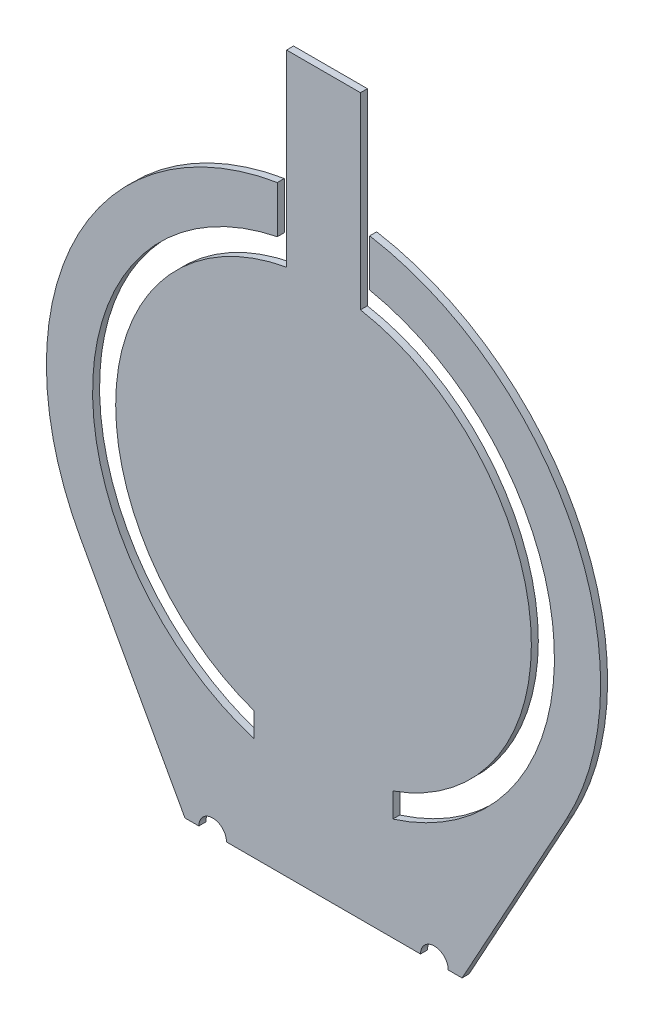
from build123d import *

# Parameters (mm, degrees)
BOSS_EXTRUDE1_DEPTH      = 0.75438
CORTE_EXTRUS_O1_START    = -10
CORTE_EXTRUS_O1_DEPTH    = 10
RESSALTO_EXTRUS_O1_START = -0.75438
RESSALTO_EXTRUS_O1_DEPTH = 0.75438
CORTE_EXTRUS_O2_DEPTH    = 10


with BuildPart() as part:
    # Sketch1 → Boss-Extrude1 (new body)
    with BuildSketch(Plane.XY):
        with BuildLine():
            Line((-15, -35), (15, -35))
            Line((15, -35), (26.292884648, -14.44590658))
            ThreePointArc((26.292884648, -14.44590658), (0, 30), (-26.292884648, -14.44590658))
            Line((-26.292884648, -14.44590658), (-15, -35))
        make_face()
        with BuildLine():
            Line((-7.5, -23.848480035), (-7.5, -21.213203436))
            ThreePointArc((-7.5, -21.213203436), (0, 22.5), (7.5, -21.213203436))
            Line((7.5, -21.213203436), (7.5, -23.848480035))
            ThreePointArc((7.5, -23.848480035), (0, 25), (-7.5, -23.848480035))
        make_face(mode=Mode.SUBTRACT)
    extrude(amount=BOSS_EXTRUDE1_DEPTH)

    # Esboço1 → Corte-extrusão1 (cut)
    with BuildSketch(Plane.XY.offset(0.75438).offset(CORTE_EXTRUS_O1_START)):
        with BuildLine():
            ThreePointArc((-5, 29.580398915), (-2.508787808, 29.894915684), (0, 30))
            ThreePointArc((0, 30), (2.508787808, 29.894915684), (5, 29.580398915))
            Line((5, 29.580398915), (5, 30.901392532))
            Line((5, 30.901392532), (-5, 30.901392532))
            Line((-5, 30.901392532), (-5, 29.580398915))
        make_face()
        with BuildLine():
            Line((0, 27.5), (0, 30))
            ThreePointArc((0, 30), (-2.508787808, 29.894915684), (-5, 29.580398915))
            Line((-5, 29.580398915), (-5, 27.5))
            Line((-5, 27.5), (0, 27.5))
        make_face()
        with BuildLine():
            ThreePointArc((5, 29.580398915), (2.508787808, 29.894915684), (0, 30))
            Line((0, 30), (0, 27.5))
            Line((0, 27.5), (5, 27.5))
            Line((5, 27.5), (5, 29.580398915))
        make_face()
        with BuildLine():
            Line((5, 27.5), (0, 27.5))
            Line((0, 27.5), (0, 25))
            ThreePointArc((0, 25), (2.51272405, 24.873403825), (5, 24.494897428))
            Line((5, 24.494897428), (5, 27.5))
        make_face()
        with BuildLine():
            Line((0, 25), (0, 27.5))
            Line((0, 27.5), (-5, 27.5))
            Line((-5, 27.5), (-5, 24.494897428))
            ThreePointArc((-5, 24.494897428), (-2.51272405, 24.873403825), (0, 25))
        make_face()
        with BuildLine():
            ThreePointArc((5, 24.494897428), (2.51272405, 24.873403825), (0, 25))
            ThreePointArc((0, 25), (-2.51272405, 24.873403825), (-5, 24.494897428))
            Line((-5, 24.494897428), (-5, 24.098607468))
            Line((-5, 24.098607468), (5, 24.098607468))
            Line((5, 24.098607468), (5, 24.494897428))
        make_face()
    extrude(amount=CORTE_EXTRUS_O1_DEPTH, mode=Mode.SUBTRACT)

    # Esboço3 → Ressalto-extrusão1 (add)
    with BuildSketch(Plane.XY.offset(0.75438).offset(RESSALTO_EXTRUS_O1_START)):
        with BuildLine():
            ThreePointArc((-4, 22.141589825), (-2.008012566, 22.410218329), (0, 22.5))
            Line((0, 22.5), (0, 42.5))
            Line((0, 42.5), (-4, 42.5))
            Line((-4, 42.5), (-4, 24.494897428))
            Line((-4, 24.494897428), (-4, 22.141589825))
        make_face()
        with BuildLine():
            Line((0, 42.5), (0, 22.5))
            ThreePointArc((0, 22.5), (2.008012566, 22.410218329), (4, 22.141589825))
            Line((4, 22.141589825), (4, 42.5))
            Line((4, 42.5), (0, 42.5))
        make_face()
    extrude(amount=RESSALTO_EXTRUS_O1_DEPTH)

    # Esboço4 → Corte-extrusão2 (cut)
    with BuildSketch(Plane.XY.offset(0.75438)):
        with BuildLine():
            ThreePointArc((-10.5, -35), (-12, -33.5), (-13.5, -35))
            Line((-13.5, -35), (-12, -35))
            Line((-12, -35), (-10.5, -35))
        make_face()
        with BuildLine():
            Line((-12, -35), (-13.5, -35))
            ThreePointArc((-13.5, -35), (-12, -36.5), (-10.5, -35))
            Line((-10.5, -35), (-12, -35))
        make_face()
        with BuildLine():
            ThreePointArc((13.5, -35), (12, -33.5), (10.5, -35))
            Line((10.5, -35), (13.5, -35))
        make_face()
        with BuildLine():
            Line((13.5, -35), (10.5, -35))
            ThreePointArc((10.5, -35), (12, -36.5), (13.5, -35))
        make_face()
    extrude(amount=-CORTE_EXTRUS_O2_DEPTH, mode=Mode.SUBTRACT)


solid = part.part
